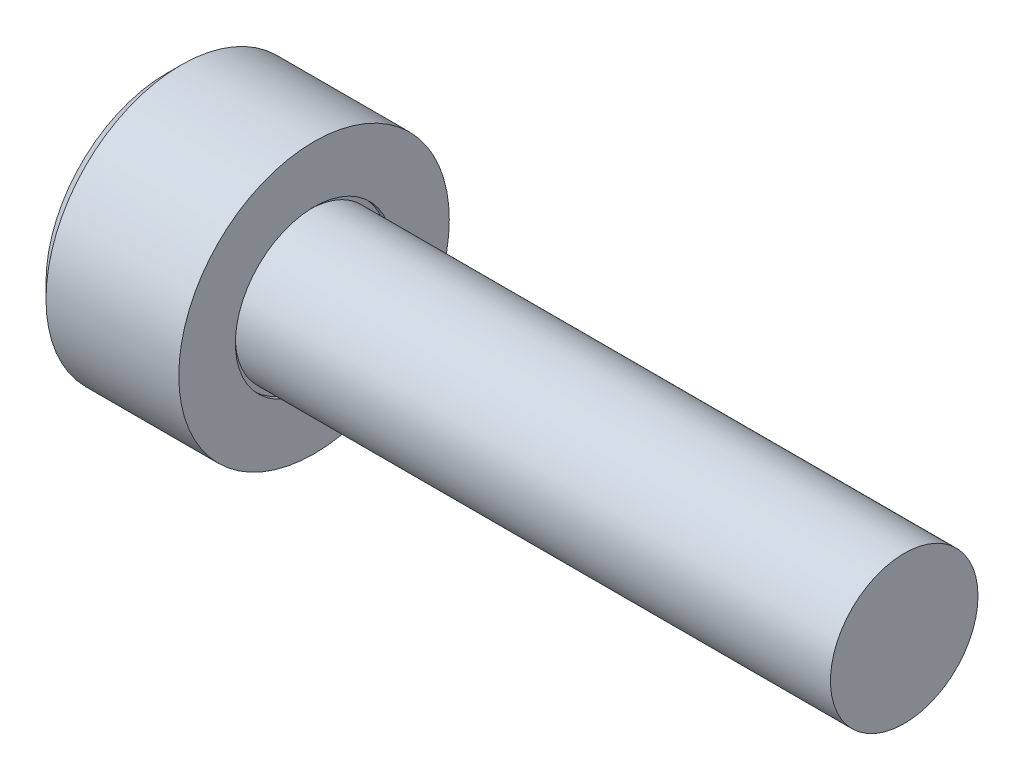
from build123d import *

# Parameters (mm, degrees)
SKETCH_1_W          = 3
SKETCH_1_H          = 2.75
SKETCH_2_R          = 1.5
EXTRUDE_1_DEPTH     = 100
CUT_EXTRUDE_1_DEPTH = 1.5
CHAMFER_1_SIZE      = 0.3
CUT_EXTRUDE_START   = -0.1
SKETCH_5_R          = 1.6
SKETCH_5_R_2        = 1.5
CUT_EXTRUDE_2_DEPTH = 0.1


with BuildPart() as part:
    # ｽｹｯﾁ1 → 回転1 (revolve)
    with BuildSketch(Plane.XY, mode=Mode.PRIVATE) as revolve_1_sk:
        with Locations((-1.5, 1.375)):
            Rectangle(SKETCH_1_W, SKETCH_1_H)
    revolve(revolve_1_sk.sketch.rotate(Axis((-3, 0, 0), (1, 0, 0)), 270), axis=Axis((-3, 0, 0), (1, 0, 0)))

    # ｽｹｯﾁ2 → ﾎﾞｽ - 押し出し1 (add)
    with BuildSketch(Plane(origin=(0, 0, 0), x_dir=(0, 0, -1), z_dir=(1, 0, 0))):
        Circle(SKETCH_2_R)
    extrude(amount=EXTRUDE_1_DEPTH)

    # ｽｹｯﾁ3 → ｶｯﾄ - 押し出し1 (cut)
    with BuildSketch(Plane.ZY.offset(3)):
        Polygon((-0.72, -1.247076581), (0.72, -1.247076581), (1.44, 0), (0.72, 1.247076581), (-0.72, 1.247076581), (-1.44, 0), align=None)
    extrude(amount=-CUT_EXTRUDE_1_DEPTH, mode=Mode.SUBTRACT)

    # ｽｹｯﾁ4 → ｶｯﾄ - 回転1 (revolve, cut)
    with BuildSketch(Plane.XY, mode=Mode.PRIVATE) as cut_revolve_1_sk:
        Polygon((-1.5, 1.247076581), (-1.5, 0), (-1.165063509, 0), align=None)
    revolve(cut_revolve_1_sk.sketch.rotate(Axis((-1.500025, 0, 0), (1, 0, 0)), 90), axis=Axis((-1.500025, 0, 0), (1, 0, 0)), mode=Mode.SUBTRACT)

    # 面取り1
    chamfer_1_edges = [part.edges().sort_by_distance(p)[0] for p in [
        (100, 0, 1.5),
        (-3, 0, 2.75),
    ]]
    chamfer(chamfer_1_edges, length=CHAMFER_1_SIZE)

    # ｽｹｯﾁ5 → ｶｯﾄ - 押し出し2 (cut)
    with BuildSketch(Plane(origin=(0, 0, 0), x_dir=(0, 0, -1), z_dir=(1, 0, 0)).offset(CUT_EXTRUDE_START)):
        Circle(SKETCH_5_R)
        Circle(SKETCH_5_R_2, mode=Mode.SUBTRACT)
    extrude(amount=CUT_EXTRUDE_2_DEPTH, mode=Mode.SUBTRACT)

    # Surface Cut 14
    split(bisect_by=Plane(origin=(12, 0, 0), x_dir=(0, 0, -1), z_dir=(1, 0, 0)), keep=Keep.BOTTOM)


solid = part.part
